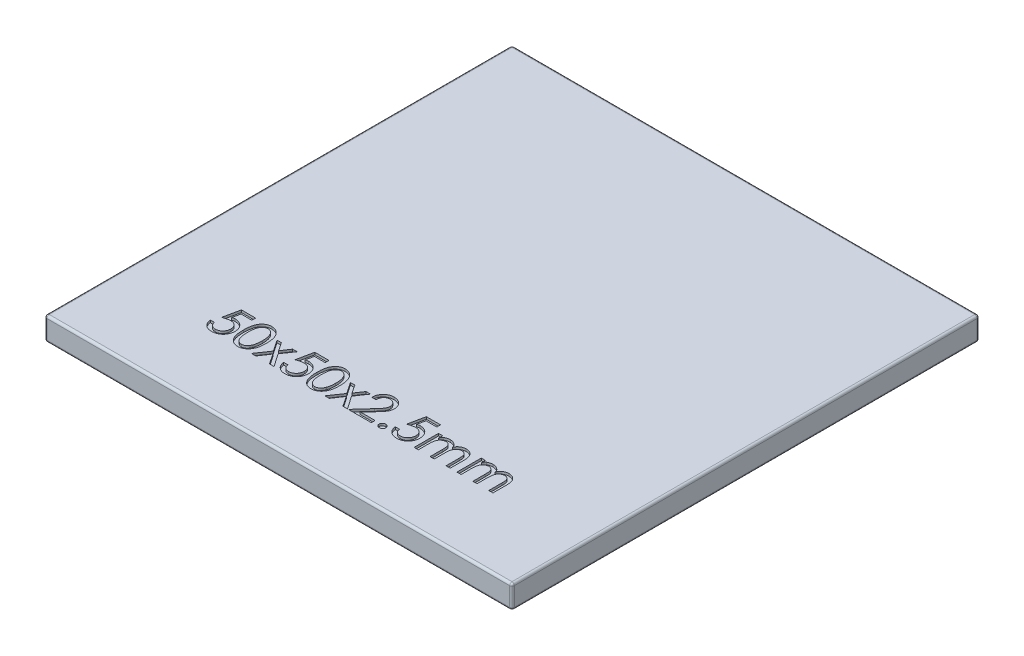
from build123d import *

# Parameters (mm, degrees)
ESQUISSE1_W             = 50
ESQUISSE1_H             = 50
BOSS_EXTRU_1_DEPTH      = 2.5
ENL_V_MAT_EXTRU_1_DEPTH = 0.25
CONG_1_R                = 0.25


with BuildPart() as part:
    # Esquisse1 → Boss.-Extru.1 (new body)
    with BuildSketch(Plane(origin=(0, 0, 0), x_dir=(1, 0, 0), z_dir=(0, 1, 0))):
        Rectangle(ESQUISSE1_W, ESQUISSE1_H)
    extrude(amount=BOSS_EXTRU_1_DEPTH)

    # Esquisse2 → Enlèv. mat.-Extru.1 (cut)
    # profile 1 of 11: a face of its own
    with BuildSketch(Plane(origin=(0, 2.5, 0), x_dir=(1, 0, 0), z_dir=(0, 1, 0))):
        with BuildLine():
            Line((-13.38499469, -14.045596726), (-13.38499469, -14.44944288))
            Line((-13.38499469, -14.44944288), (-14.534834434, -14.44944288))
            Line((-14.534834434, -14.44944288), (-14.722735075, -15.278869963))
            add(Edge.make_bspline(
                [(-14.722735075, -15.278869963), (-14.70081411, -15.26830555), (-14.655700591, -15.246563904), (-14.58027764, -15.227620307), (-14.498389797, -15.214291611), (-14.44118187, -15.212957207), (-14.411436998, -15.212263393)],
                knots=[0, 0, 0, 0, 0.906577793, 1.865744317, 2.890308309, 4, 4, 4, 4], degree=3))
            add(Edge.make_bspline(
                [(-14.411436998, -15.212263393), (-14.369309188, -15.213034712), (-14.286598278, -15.21454907), (-14.166053753, -15.231471453), (-14.051186261, -15.256823449), (-13.942940752, -15.294643919), (-13.840081092, -15.34120271), (-13.743723196, -15.399464273), (-13.653967144, -15.4684403), (-13.570932987, -15.54695631), (-13.495254616, -15.63247908), (-13.430257165, -15.72483536), (-13.373915452, -15.821327111), (-13.329256004, -15.923621805), (-13.293970415, -16.030661311), (-13.268876192, -16.142892995), (-13.252923094, -16.259980582), (-13.251234975, -16.339848851), (-13.250379306, -16.380332303)],
                knots=[0, 0, 0, 0, 1.094894284, 2.149641875, 3.159658044, 4.149576056, 5.125966368, 6.091225838, 7.071072142, 8.064343292, 9.05924964, 10.03573454, 10.996966885, 11.96032995, 12.932910184, 13.923798045, 14.947619342, 16, 16, 16, 16], degree=3))
            add(Edge.make_bspline(
                [(-13.250379306, -16.380332303), (-13.251037294, -16.408621201), (-13.252338906, -16.464581392), (-13.259121471, -16.547790572), (-13.272068141, -16.629204886), (-13.28925789, -16.709453181), (-13.312944013, -16.787847502), (-13.339907654, -16.865430069), (-13.373034638, -16.940964068), (-13.41085442, -17.014418008), (-13.452815165, -17.085254326), (-13.499015891, -17.152613722), (-13.549562156, -17.215957663), (-13.604633315, -17.274755973), (-13.66272401, -17.33052089), (-13.725349584, -17.381796998), (-13.792332072, -17.428799668), (-13.862716029, -17.472042705), (-13.93646781, -17.511109504), (-14.014020861, -17.543456021), (-14.093449877, -17.572845763), (-14.176719309, -17.594851881), (-14.262259074, -17.61336915), (-14.351095732, -17.625657796), (-14.442606562, -17.63366971), (-14.504668659, -17.63477706), (-14.536236677, -17.635340316)],
                knots=[0, 0, 0, 0, 1.012275937, 2.002451767, 2.98397589, 3.959820946, 4.936095762, 5.911940818, 6.896771482, 7.884012822, 8.866284557, 9.840372785, 10.804070441, 11.762530572, 12.720625922, 13.68308951, 14.655094125, 15.646011038, 16.637104318, 17.63729087, 18.650257215, 19.66446511, 20.715636712, 21.77986274, 22.870722459, 24, 24, 24, 24], degree=3))
            add(Edge.make_bspline(
                [(-14.536236677, -17.635340316), (-14.571791564, -17.63448672), (-14.641934004, -17.632802754), (-14.744952563, -17.620858768), (-14.843781968, -17.600593357), (-14.938003432, -17.571583661), (-15.028317967, -17.535197438), (-15.113955587, -17.490185576), (-15.195249081, -17.436952052), (-15.272303132, -17.376511708), (-15.342579468, -17.307565381), (-15.407358765, -17.233342434), (-15.462551263, -17.151110174), (-15.511103926, -17.06313791), (-15.552821368, -16.968710128), (-15.586009704, -16.867647792), (-15.612547686, -16.760333629), (-15.623154631, -16.686140859), (-15.628584434, -16.648160829)],
                knots=[0, 0, 0, 0, 1.049569621, 2.070583864, 3.057046508, 4.023914414, 4.977170942, 5.927726879, 6.875021894, 7.842677272, 8.813672282, 9.777581439, 10.74592533, 11.731059957, 12.74126976, 13.788569057, 14.867946107, 16, 16, 16, 16], degree=3))
            Line((-15.628584434, -16.648160829), (-15.190383312, -16.648160829))
            add(Edge.make_bspline(
                [(-15.190383312, -16.648160829), (-15.182043373, -16.684840389), (-15.166387354, -16.753696521), (-15.132753701, -16.847517676), (-15.096705811, -16.927313335), (-15.052615991, -16.99257233), (-15.002012059, -17.046139898), (-14.9458453, -17.092638085), (-14.884139146, -17.134347997), (-14.816207016, -17.168970778), (-14.744632979, -17.19702081), (-14.670265135, -17.216597857), (-14.594605371, -17.228907794), (-14.543527292, -17.230632473), (-14.518007511, -17.231494162)],
                knots=[0, 0, 0, 0, 1.385459112, 2.600831482, 3.66841355, 4.605180919, 5.48910649, 6.376050311, 7.288896949, 8.229144678, 9.181161654, 10.117453426, 11.059436513, 12, 12, 12, 12], degree=3))
            add(Edge.make_bspline(
                [(-14.518007511, -17.231494162), (-14.490400879, -17.230567347), (-14.435896778, -17.228737526), (-14.355603414, -17.217783243), (-14.278813124, -17.197520747), (-14.204417201, -17.171256892), (-14.133715111, -17.135484428), (-14.064971414, -17.093715487), (-14.000692796, -17.042424399), (-13.939082758, -16.985394746), (-13.882654166, -16.922225413), (-13.833518856, -16.85397374), (-13.791604297, -16.782010245), (-13.758202005, -16.705856278), (-13.73109316, -16.626209646), (-13.712459645, -16.542526342), (-13.700834242, -16.454981175), (-13.699683868, -16.395327156), (-13.699097254, -16.364907623)],
                knots=[0, 0, 0, 0, 0.99750234, 1.969380735, 2.919490565, 3.862219911, 4.813679117, 5.776605688, 6.762898166, 7.778387729, 8.806918829, 9.816812977, 10.811632172, 11.809420289, 12.815921014, 13.846113939, 14.901663155, 16, 16, 16, 16], degree=3))
            add(Edge.make_bspline(
                [(-13.699097254, -16.364907623), (-13.699794754, -16.337766464), (-13.701164354, -16.28447255), (-13.711196941, -16.206581659), (-13.727110648, -16.132283375), (-13.750234626, -16.062276151), (-13.779959631, -15.996172616), (-13.816512186, -15.934395646), (-13.859780889, -15.87660122), (-13.908440857, -15.822602044), (-13.963525004, -15.774353425), (-14.022669183, -15.731171801), (-14.087669314, -15.696247614), (-14.156181226, -15.666361547), (-14.229789672, -15.644519691), (-14.307176059, -15.626920114), (-14.38975029, -15.618464469), (-14.446245914, -15.616908209), (-14.475239081, -15.616109546)],
                knots=[0, 0, 0, 0, 1.071512717, 2.104004018, 3.095982969, 4.067795438, 5.009520676, 5.952827242, 6.895998369, 7.856350385, 8.817411605, 9.782937659, 10.74115891, 11.725120868, 12.729302161, 13.768330494, 14.854722481, 16, 16, 16, 16], degree=3))
            add(Edge.make_bspline(
                [(-14.475239081, -15.616109546), (-14.500032221, -15.616704548), (-14.552082866, -15.617953693), (-14.633532868, -15.626985931), (-14.722166627, -15.641192376), (-14.817843986, -15.660840669), (-14.920656886, -15.686438419), (-15.030730262, -15.717456616), (-15.14818591, -15.753651181), (-15.228323175, -15.781334314), (-15.269610075, -15.795596726)],
                knots=[0, 0, 0, 0, 0.727614075, 1.527550888, 2.402655696, 3.361819828, 4.39328773, 5.511706796, 6.718025739, 8, 8, 8, 8], degree=3))
            Line((-15.269610075, -15.795596726), (-14.902222254, -14.045596726))
            Line((-14.902222254, -14.045596726), (-13.38499469, -14.045596726))
        make_face()
    # profile 2 of 11: a face of its own
    with BuildSketch(Plane(origin=(0, 2.5, 0), x_dir=(1, 0, 0), z_dir=(0, 1, 0))):
        with BuildLine():
            add(Edge.make_bspline(
                [(-12.936276741, -15.79699897), (-12.935942684, -15.741369755), (-12.935293931, -15.633335649), (-12.92830333, -15.476173695), (-12.916244027, -15.328653606), (-12.900754276, -15.190771005), (-12.879324617, -15.062431158), (-12.854804648, -14.943570644), (-12.824621316, -14.83417484), (-12.789366151, -14.73404854), (-12.749781691, -14.641413469), (-12.706258388, -14.555109283), (-12.659071898, -14.47404024), (-12.608540914, -14.398234575), (-12.552276483, -14.329381132), (-12.493581709, -14.265121878), (-12.430252742, -14.206711206), (-12.362869934, -14.154441544), (-12.293166044, -14.10718477), (-12.220316872, -14.067353612), (-12.146010365, -14.032656877), (-12.069298948, -14.00459023), (-11.990738814, -13.982787796), (-11.910048614, -13.967561942), (-11.827612039, -13.95707677), (-11.771746309, -13.956262422), (-11.743668568, -13.955853136)],
                knots=[0, 0, 0, 0, 1.622528522, 3.151013738, 4.587225782, 5.939257941, 7.196658267, 8.381214254, 9.47772444, 10.503964975, 11.475138444, 12.414102326, 13.321377868, 14.209997518, 15.068075989, 15.912287155, 16.746865696, 17.577313739, 18.397854368, 19.200328723, 19.996378645, 20.787862277, 21.580050128, 22.371504404, 23.181529048, 24, 24, 24, 24], degree=3))
            add(Edge.make_bspline(
                [(-11.743668568, -13.955853136), (-11.71303882, -13.956659739), (-11.652581137, -13.958251829), (-11.562859019, -13.966916081), (-11.476145074, -13.984420752), (-11.391249547, -14.006372291), (-11.309547532, -14.03638052), (-11.229420615, -14.070888608), (-11.153335057, -14.114596332), (-11.078695732, -14.162406644), (-11.008061803, -14.217541376), (-10.940503252, -14.277449123), (-10.878126402, -14.34417484), (-10.818657503, -14.415422513), (-10.765146968, -14.49398249), (-10.714206491, -14.57710394), (-10.66910195, -14.666856978), (-10.626307583, -14.761653877), (-10.58952328, -14.864015284), (-10.556229968, -14.973356642), (-10.52924938, -15.091040216), (-10.506868077, -15.216700271), (-10.489620106, -15.350548366), (-10.476882039, -15.49226656), (-10.470231542, -15.641987347), (-10.468973818, -15.744409153), (-10.468328024, -15.79699897)],
                knots=[0, 0, 0, 0, 0.875057392, 1.727207867, 2.570264412, 3.399251263, 4.229017074, 5.053828049, 5.887584622, 6.731829445, 7.583639997, 8.443960147, 9.308026848, 10.190032267, 11.091770676, 12.020167189, 12.972467704, 13.958579741, 14.989078804, 16.076606933, 17.221320015, 18.435081626, 19.720875061, 21.074561036, 22.497895074, 24, 24, 24, 24], degree=3))
            add(Edge.make_bspline(
                [(-10.468328024, -15.79699897), (-10.468980588, -15.84935427), (-10.470251345, -15.951307311), (-10.476806397, -16.10033928), (-10.489874618, -16.241286721), (-10.505965006, -16.374545235), (-10.528534357, -16.499710109), (-10.556015132, -16.616847466), (-10.586832599, -16.726573181), (-10.62450546, -16.827925601), (-10.666220235, -16.922610547), (-10.711477952, -17.011561039), (-10.76132207, -17.094952367), (-10.81651226, -17.171879745), (-10.874418673, -17.244763767), (-10.937556972, -17.311071309), (-11.004776485, -17.372066238), (-11.075914631, -17.42697176), (-11.150157163, -17.476485512), (-11.227969818, -17.518281102), (-11.307391119, -17.55537885), (-11.390194333, -17.583493459), (-11.474700956, -17.607486971), (-11.562333952, -17.6229855), (-11.652279833, -17.633246848), (-11.713023946, -17.634638331), (-11.743668568, -17.635340316)],
                knots=[0, 0, 0, 0, 1.496607488, 2.914388442, 4.262485651, 5.541812885, 6.749953981, 7.895567619, 8.980172623, 10.005210728, 10.983286874, 11.936336572, 12.856292636, 13.757107149, 14.640766483, 15.514956722, 16.370989637, 17.232841377, 18.081413197, 18.918442167, 19.755471137, 20.583656588, 21.41504191, 22.264086897, 23.124254193, 24, 24, 24, 24], degree=3))
            add(Edge.make_bspline(
                [(-11.743668568, -17.635340316), (-11.77197137, -17.634859396), (-11.828027088, -17.6339069), (-11.91080235, -17.624565153), (-11.991437333, -17.609061119), (-12.069695208, -17.587331554), (-12.146125829, -17.559743356), (-12.220397744, -17.52632411), (-12.292022783, -17.485857491), (-12.361684485, -17.440389839), (-12.428371122, -17.38867373), (-12.490485124, -17.330221582), (-12.549519915, -17.266430317), (-12.604305974, -17.196612028), (-12.656053997, -17.121217423), (-12.702704071, -17.039536186), (-12.746197076, -16.952440701), (-12.786520554, -16.859260121), (-12.822928853, -16.758375483), (-12.85196775, -16.647813066), (-12.879351148, -16.528779315), (-12.89944662, -16.400070044), (-12.91688204, -16.262656261), (-12.926997323, -16.115645932), (-12.935641612, -15.959526623), (-12.93606115, -15.852168125), (-12.936276741, -15.79699897)],
                knots=[0, 0, 0, 0, 0.82614074, 1.636230647, 2.42850654, 3.22151677, 4.005075515, 4.799112676, 5.596456327, 6.404618302, 7.226350817, 8.05679228, 8.892237205, 9.761873943, 10.645770802, 11.559890835, 12.505927976, 13.487073095, 14.523090282, 15.633895838, 16.822583925, 18.088023083, 19.435493537, 20.865857947, 22.389433785, 24, 24, 24, 24], degree=3))
        make_face()
        with BuildLine():
            add(Edge.make_bspline(
                [(-12.487558793, -15.795596726), (-12.487378562, -15.842577407), (-12.487029647, -15.933528492), (-12.481848825, -16.065138702), (-12.474472732, -16.187688362), (-12.463439285, -16.301144244), (-12.448726544, -16.405675052), (-12.431312556, -16.501136429), (-12.411457997, -16.587711263), (-12.387251954, -16.665541814), (-12.360449579, -16.736457581), (-12.330648788, -16.801744465), (-12.299705602, -16.862881553), (-12.264849047, -16.918657065), (-12.227935093, -16.969833212), (-12.188297181, -17.016215194), (-12.147350326, -17.058819685), (-12.088938871, -17.106127951), (-12.01409629, -17.155588694), (-11.921188131, -17.198478174), (-11.827579881, -17.226789464), (-11.764426016, -17.229935982), (-11.733151741, -17.231494162)],
                knots=[0, 0, 0, 0, 1.564601651, 3.028951736, 4.386019676, 5.653114642, 6.824348509, 7.900668805, 8.88431448, 9.780488761, 10.613163047, 11.407444027, 12.169849642, 12.89344098, 13.595615509, 14.26934431, 14.924332585, 15.560171042, 16.769153194, 17.901006317, 18.960562374, 20, 20, 20, 20], degree=3))
            add(Edge.make_bspline(
                [(-11.733151741, -17.231494162), (-11.697711693, -17.229639816), (-11.627052144, -17.225942663), (-11.522987625, -17.199022716), (-11.423206885, -17.153841378), (-11.344145184, -17.102796679), (-11.284410876, -17.053149477), (-11.241271879, -17.010884841), (-11.201510152, -16.963699291), (-11.163973784, -16.912311349), (-11.130033358, -16.855880379), (-11.097306976, -16.795687153), (-11.068812432, -16.730287542), (-11.052344099, -16.684714146), (-11.043949017, -16.661482143)],
                knots=[0, 0, 0, 0, 1.331887272, 2.655486065, 4.012646414, 5.436183829, 6.178803566, 6.930724497, 7.703763371, 8.496530827, 9.320959298, 10.178042319, 11.071218497, 12, 12, 12, 12], degree=3))
            add(Edge.make_bspline(
                [(-11.043949017, -16.661482143), (-11.03383488, -16.630958588), (-11.013216511, -16.568734207), (-10.987384529, -16.47185497), (-10.965998828, -16.370199532), (-10.947584548, -16.264309264), (-10.933602557, -16.153650695), (-10.923938064, -16.038330414), (-10.918394372, -15.918347711), (-10.917500435, -15.836968542), (-10.917045972, -15.795596726)],
                knots=[0, 0, 0, 0, 0.877617242, 1.789083553, 2.735016418, 3.71249782, 4.722174671, 5.778575778, 6.870664861, 8, 8, 8, 8], degree=3))
            add(Edge.make_bspline(
                [(-10.917045972, -15.795596726), (-10.917154744, -15.754220673), (-10.917366869, -15.673530444), (-10.92367142, -15.555500379), (-10.931296103, -15.443151509), (-10.944450093, -15.336852794), (-10.959171469, -15.23607375), (-10.979364027, -15.141526883), (-11.001021705, -15.052268328), (-11.028078452, -14.96940051), (-11.057659548, -14.892087545), (-11.088859108, -14.820072086), (-11.122593569, -14.753296511), (-11.159760972, -14.69259868), (-11.198989673, -14.636977341), (-11.240426031, -14.586767004), (-11.284687481, -14.54225029), (-11.346566494, -14.492056745), (-11.426336309, -14.439816152), (-11.5260818, -14.392932972), (-11.629079004, -14.365293927), (-11.698641899, -14.361554435), (-11.733151741, -14.35969929)],
                knots=[0, 0, 0, 0, 1.353201578, 2.638969622, 3.865559904, 5.035676431, 6.141732754, 7.195734042, 8.19695873, 9.144657206, 10.044788335, 10.904062871, 11.710933862, 12.489720227, 13.229995877, 13.935715626, 14.616825307, 15.279494989, 16.538995736, 17.725922936, 18.871840505, 20, 20, 20, 20], degree=3))
            add(Edge.make_bspline(
                [(-11.733151741, -14.35969929), (-11.764416997, -14.361287915), (-11.827778026, -14.364507364), (-11.92152834, -14.392425459), (-12.01410204, -14.435655009), (-12.0884431, -14.485149987), (-12.146371487, -14.532408082), (-12.187877358, -14.574043537), (-12.226223564, -14.620687605), (-12.263228981, -14.671451818), (-12.297019043, -14.727594184), (-12.329838136, -14.788090553), (-12.358754044, -14.853940435), (-12.38594778, -14.924910531), (-12.409898865, -15.002883326), (-12.430611561, -15.089326027), (-12.449120859, -15.184681856), (-12.462460449, -15.289423621), (-12.473674162, -15.403051866), (-12.482066418, -15.525793592), (-12.486966475, -15.657668501), (-12.487357045, -15.74861725), (-12.487558793, -15.795596726)],
                knots=[0, 0, 0, 0, 1.039778295, 2.107176824, 3.232337611, 4.43520669, 5.071253539, 5.720927637, 6.389866065, 7.081397607, 7.811854436, 8.571243718, 9.372887587, 10.205834777, 11.102302774, 12.088086757, 13.166194718, 14.33675119, 15.604261439, 16.970055543, 18.43488556, 20, 20, 20, 20], degree=3))
        make_face(mode=Mode.SUBTRACT)
    # profile 3 of 11: a face of its own
    with BuildSketch(Plane(origin=(0, 2.5, 0), x_dir=(1, 0, 0), z_dir=(0, 1, 0))):
        Polygon((-10.199097254, -14.943032623), (-9.722334434, -14.943032623), (-9.126380908, -15.841870764), (-8.531128504, -14.943032623), (-8.0452511, -14.943032623), (-8.868368088, -16.149663232), (-7.910635716, -17.545596726), (-8.397214241, -17.545596726), (-9.12708203, -16.456754579), (-9.856248697, -17.545596726), (-10.333712639, -17.545596726), (-9.375279145, -16.150364354), align=None)
    # profile 4 of 11: a face of its own
    with BuildSketch(Plane(origin=(0, 2.5, 0), x_dir=(1, 0, 0), z_dir=(0, 1, 0))):
        with BuildLine():
            Line((-5.532430588, -14.045596726), (-5.532430588, -14.44944288))
            Line((-5.532430588, -14.44944288), (-6.682270331, -14.44944288))
            Line((-6.682270331, -14.44944288), (-6.870170972, -15.278869963))
            add(Edge.make_bspline(
                [(-6.870170972, -15.278869963), (-6.848250008, -15.26830555), (-6.803136489, -15.246563904), (-6.727713537, -15.227620307), (-6.645825694, -15.214291611), (-6.588617767, -15.212957207), (-6.558872895, -15.212263393)],
                knots=[0, 0, 0, 0, 0.906577793, 1.865744317, 2.890308309, 4, 4, 4, 4], degree=3))
            add(Edge.make_bspline(
                [(-6.558872895, -15.212263393), (-6.516745086, -15.213034712), (-6.434034175, -15.21454907), (-6.31348965, -15.231471453), (-6.198622159, -15.256823449), (-6.090376649, -15.294643919), (-5.987516989, -15.34120271), (-5.891159094, -15.399464273), (-5.801403042, -15.4684403), (-5.718368884, -15.54695631), (-5.642690514, -15.63247908), (-5.577693063, -15.72483536), (-5.521351349, -15.821327111), (-5.476691901, -15.923621805), (-5.441406313, -16.030661311), (-5.416312089, -16.142892995), (-5.400358991, -16.259980582), (-5.398670873, -16.339848851), (-5.397815203, -16.380332303)],
                knots=[0, 0, 0, 0, 1.094894284, 2.149641875, 3.159658044, 4.149576056, 5.125966368, 6.091225838, 7.071072142, 8.064343292, 9.05924964, 10.03573454, 10.996966885, 11.96032995, 12.932910184, 13.923798045, 14.947619342, 16, 16, 16, 16], degree=3))
            add(Edge.make_bspline(
                [(-5.397815203, -16.380332303), (-5.398473192, -16.408621201), (-5.399774804, -16.464581392), (-5.406557369, -16.547790572), (-5.419504038, -16.629204886), (-5.436693788, -16.709453181), (-5.460379911, -16.787847502), (-5.487343551, -16.865430069), (-5.520470535, -16.940964068), (-5.558290317, -17.014418008), (-5.600251062, -17.085254326), (-5.646451788, -17.152613722), (-5.696998053, -17.215957663), (-5.752069213, -17.274755973), (-5.810159908, -17.33052089), (-5.872785481, -17.381796998), (-5.939767969, -17.428799668), (-6.010151926, -17.472042705), (-6.083903707, -17.511109504), (-6.161456758, -17.543456021), (-6.240885774, -17.572845763), (-6.324155207, -17.594851881), (-6.409694971, -17.61336915), (-6.498531629, -17.625657796), (-6.590042459, -17.63366971), (-6.652104557, -17.63477706), (-6.683672575, -17.635340316)],
                knots=[0, 0, 0, 0, 1.012275937, 2.002451767, 2.98397589, 3.959820946, 4.936095762, 5.911940818, 6.896771482, 7.884012822, 8.866284557, 9.840372785, 10.804070441, 11.762530572, 12.720625922, 13.68308951, 14.655094125, 15.646011038, 16.637104318, 17.63729087, 18.650257215, 19.66446511, 20.715636712, 21.77986274, 22.870722459, 24, 24, 24, 24], degree=3))
            add(Edge.make_bspline(
                [(-6.683672575, -17.635340316), (-6.719227461, -17.63448672), (-6.789369902, -17.632802754), (-6.89238846, -17.620858768), (-6.991217865, -17.600593357), (-7.085439329, -17.571583661), (-7.175753864, -17.535197438), (-7.261391485, -17.490185576), (-7.342684978, -17.436952052), (-7.41973903, -17.376511708), (-7.490015366, -17.307565381), (-7.554794663, -17.233342434), (-7.609987161, -17.151110174), (-7.658539823, -17.06313791), (-7.700257265, -16.968710128), (-7.733445602, -16.867647792), (-7.759983583, -16.760333629), (-7.770590529, -16.686140859), (-7.776020331, -16.648160829)],
                knots=[0, 0, 0, 0, 1.049569621, 2.070583864, 3.057046508, 4.023914414, 4.977170942, 5.927726879, 6.875021894, 7.842677272, 8.813672282, 9.777581439, 10.74592533, 11.731059957, 12.74126976, 13.788569057, 14.867946107, 16, 16, 16, 16], degree=3))
            Line((-7.776020331, -16.648160829), (-7.337819209, -16.648160829))
            add(Edge.make_bspline(
                [(-7.337819209, -16.648160829), (-7.329479271, -16.684840389), (-7.313823251, -16.753696521), (-7.280189599, -16.847517676), (-7.244141708, -16.927313335), (-7.200051889, -16.99257233), (-7.149447956, -17.046139898), (-7.093281198, -17.092638085), (-7.031575044, -17.134347997), (-6.963642914, -17.168970778), (-6.892068876, -17.19702081), (-6.817701033, -17.216597857), (-6.742041269, -17.228907794), (-6.690963189, -17.230632473), (-6.665443408, -17.231494162)],
                knots=[0, 0, 0, 0, 1.385459112, 2.600831482, 3.66841355, 4.605180919, 5.48910649, 6.376050311, 7.288896949, 8.229144678, 9.181161654, 10.117453426, 11.059436513, 12, 12, 12, 12], degree=3))
            add(Edge.make_bspline(
                [(-6.665443408, -17.231494162), (-6.637836776, -17.230567347), (-6.583332675, -17.228737526), (-6.503039312, -17.217783243), (-6.426249022, -17.197520747), (-6.351853099, -17.171256892), (-6.281151009, -17.135484428), (-6.212407311, -17.093715487), (-6.148128693, -17.042424399), (-6.086518655, -16.985394746), (-6.030090063, -16.922225413), (-5.980954753, -16.85397374), (-5.939040194, -16.782010245), (-5.905637902, -16.705856278), (-5.878529058, -16.626209646), (-5.859895542, -16.542526342), (-5.848270139, -16.454981175), (-5.847119765, -16.395327156), (-5.846533152, -16.364907623)],
                knots=[0, 0, 0, 0, 0.99750234, 1.969380735, 2.919490565, 3.862219911, 4.813679117, 5.776605688, 6.762898166, 7.778387729, 8.806918829, 9.816812977, 10.811632172, 11.809420289, 12.815921014, 13.846113939, 14.901663155, 16, 16, 16, 16], degree=3))
            add(Edge.make_bspline(
                [(-5.846533152, -16.364907623), (-5.847230652, -16.337766464), (-5.848600251, -16.28447255), (-5.858632839, -16.206581659), (-5.874546545, -16.132283375), (-5.897670523, -16.062276151), (-5.927395529, -15.996172616), (-5.963948083, -15.934395646), (-6.007216787, -15.87660122), (-6.055876755, -15.822602044), (-6.110960901, -15.774353425), (-6.170105081, -15.731171801), (-6.235105212, -15.696247614), (-6.303617123, -15.666361547), (-6.37722557, -15.644519691), (-6.454611956, -15.626920114), (-6.537186187, -15.618464469), (-6.593681811, -15.616908209), (-6.622674979, -15.616109546)],
                knots=[0, 0, 0, 0, 1.071512717, 2.104004018, 3.095982969, 4.067795438, 5.009520676, 5.952827242, 6.895998369, 7.856350385, 8.817411605, 9.782937659, 10.74115891, 11.725120868, 12.729302161, 13.768330494, 14.854722481, 16, 16, 16, 16], degree=3))
            add(Edge.make_bspline(
                [(-6.622674979, -15.616109546), (-6.647468118, -15.616704548), (-6.699518763, -15.617953693), (-6.780968766, -15.626985931), (-6.869602524, -15.641192376), (-6.965279883, -15.660840669), (-7.068092783, -15.686438419), (-7.178166159, -15.717456616), (-7.295621807, -15.753651181), (-7.375759073, -15.781334314), (-7.417045972, -15.795596726)],
                knots=[0, 0, 0, 0, 0.727614075, 1.527550888, 2.402655696, 3.361819828, 4.39328773, 5.511706796, 6.718025739, 8, 8, 8, 8], degree=3))
            Line((-7.417045972, -15.795596726), (-7.049658152, -14.045596726))
            Line((-7.049658152, -14.045596726), (-5.532430588, -14.045596726))
        make_face()
    # profile 5 of 11: a face of its own
    with BuildSketch(Plane(origin=(0, 2.5, 0), x_dir=(1, 0, 0), z_dir=(0, 1, 0))):
        with BuildLine():
            add(Edge.make_bspline(
                [(-5.083712639, -15.79699897), (-5.083378581, -15.741369755), (-5.082729828, -15.633335649), (-5.075739228, -15.476173695), (-5.063679925, -15.328653606), (-5.048190174, -15.190771005), (-5.026760514, -15.062431158), (-5.002240545, -14.943570644), (-4.972057214, -14.83417484), (-4.936802049, -14.73404854), (-4.897217588, -14.641413469), (-4.853694286, -14.555109283), (-4.806507796, -14.47404024), (-4.755976812, -14.398234575), (-4.69971238, -14.329381132), (-4.641017607, -14.265121878), (-4.577688639, -14.206711206), (-4.510305832, -14.154441544), (-4.440601941, -14.10718477), (-4.367752769, -14.067353612), (-4.293446262, -14.032656877), (-4.216734845, -14.00459023), (-4.138174711, -13.982787796), (-4.057484511, -13.967561942), (-3.975047936, -13.95707677), (-3.919182206, -13.956262422), (-3.891104466, -13.955853136)],
                knots=[0, 0, 0, 0, 1.622528522, 3.151013738, 4.587225782, 5.939257941, 7.196658267, 8.381214254, 9.47772444, 10.503964975, 11.475138444, 12.414102326, 13.321377868, 14.209997518, 15.068075989, 15.912287155, 16.746865696, 17.577313739, 18.397854368, 19.200328723, 19.996378645, 20.787862277, 21.580050128, 22.371504404, 23.181529048, 24, 24, 24, 24], degree=3))
            add(Edge.make_bspline(
                [(-3.891104466, -13.955853136), (-3.860474717, -13.956659739), (-3.800017034, -13.958251829), (-3.710294916, -13.966916081), (-3.623580972, -13.984420752), (-3.538685444, -14.006372291), (-3.45698343, -14.03638052), (-3.376856513, -14.070888608), (-3.300770954, -14.114596332), (-3.226131629, -14.162406644), (-3.1554977, -14.217541376), (-3.08793915, -14.277449123), (-3.0255623, -14.34417484), (-2.966093401, -14.415422513), (-2.912582865, -14.49398249), (-2.861642388, -14.57710394), (-2.816537848, -14.666856978), (-2.773743481, -14.761653877), (-2.736959178, -14.864015284), (-2.703665865, -14.973356642), (-2.676685278, -15.091040216), (-2.654303974, -15.216700271), (-2.637056004, -15.350548366), (-2.624317936, -15.49226656), (-2.617667439, -15.641987347), (-2.616409716, -15.744409153), (-2.615763921, -15.79699897)],
                knots=[0, 0, 0, 0, 0.875057392, 1.727207867, 2.570264412, 3.399251263, 4.229017074, 5.053828049, 5.887584622, 6.731829445, 7.583639997, 8.443960147, 9.308026848, 10.190032267, 11.091770676, 12.020167189, 12.972467704, 13.958579741, 14.989078804, 16.076606933, 17.221320015, 18.435081626, 19.720875061, 21.074561036, 22.497895074, 24, 24, 24, 24], degree=3))
            add(Edge.make_bspline(
                [(-2.615763921, -15.79699897), (-2.616416485, -15.84935427), (-2.617687242, -15.951307311), (-2.624242294, -16.10033928), (-2.637310515, -16.241286721), (-2.653400903, -16.374545235), (-2.675970255, -16.499710109), (-2.70345103, -16.616847466), (-2.734268496, -16.726573181), (-2.771941357, -16.827925601), (-2.813656132, -16.922610547), (-2.858913849, -17.011561039), (-2.908757967, -17.094952367), (-2.963948157, -17.171879745), (-3.02185457, -17.244763767), (-3.08499287, -17.311071309), (-3.152212383, -17.372066238), (-3.223350529, -17.42697176), (-3.29759306, -17.476485512), (-3.375405715, -17.518281102), (-3.454827016, -17.55537885), (-3.53763023, -17.583493459), (-3.622136853, -17.607486971), (-3.70976985, -17.6229855), (-3.79971573, -17.633246848), (-3.860459843, -17.634638331), (-3.891104466, -17.635340316)],
                knots=[0, 0, 0, 0, 1.496607488, 2.914388442, 4.262485651, 5.541812885, 6.749953981, 7.895567619, 8.980172623, 10.005210728, 10.983286874, 11.936336572, 12.856292636, 13.757107149, 14.640766483, 15.514956722, 16.370989637, 17.232841377, 18.081413197, 18.918442167, 19.755471137, 20.583656588, 21.41504191, 22.264086897, 23.124254193, 24, 24, 24, 24], degree=3))
            add(Edge.make_bspline(
                [(-3.891104466, -17.635340316), (-3.919407268, -17.634859396), (-3.975462985, -17.6339069), (-4.058238247, -17.624565153), (-4.13887323, -17.609061119), (-4.217131106, -17.587331554), (-4.293561726, -17.559743356), (-4.367833641, -17.52632411), (-4.439458681, -17.485857491), (-4.509120382, -17.440389839), (-4.57580702, -17.38867373), (-4.637921022, -17.330221582), (-4.696955812, -17.266430317), (-4.751741871, -17.196612028), (-4.803489895, -17.121217423), (-4.850139968, -17.039536186), (-4.893632974, -16.952440701), (-4.933956451, -16.859260121), (-4.97036475, -16.758375483), (-4.999403648, -16.647813066), (-5.026787046, -16.528779315), (-5.046882518, -16.400070044), (-5.064317937, -16.262656261), (-5.074433221, -16.115645932), (-5.083077509, -15.959526623), (-5.083497047, -15.852168125), (-5.083712639, -15.79699897)],
                knots=[0, 0, 0, 0, 0.82614074, 1.636230647, 2.42850654, 3.22151677, 4.005075515, 4.799112676, 5.596456327, 6.404618302, 7.226350817, 8.05679228, 8.892237205, 9.761873943, 10.645770802, 11.559890835, 12.505927976, 13.487073095, 14.523090282, 15.633895838, 16.822583925, 18.088023083, 19.435493537, 20.865857947, 22.389433785, 24, 24, 24, 24], degree=3))
        make_face()
        with BuildLine():
            add(Edge.make_bspline(
                [(-4.63499469, -15.795596726), (-4.634814459, -15.842577407), (-4.634465545, -15.933528492), (-4.629284722, -16.065138702), (-4.621908629, -16.187688362), (-4.610875183, -16.301144244), (-4.596162441, -16.405675052), (-4.578748454, -16.501136429), (-4.558893894, -16.587711263), (-4.534687851, -16.665541814), (-4.507885477, -16.736457581), (-4.478084686, -16.801744465), (-4.447141499, -16.862881553), (-4.412284944, -16.918657065), (-4.37537099, -16.969833212), (-4.335733079, -17.016215194), (-4.294786224, -17.058819685), (-4.236374769, -17.106127951), (-4.161532188, -17.155588694), (-4.068624029, -17.198478174), (-3.975015778, -17.226789464), (-3.911861913, -17.229935982), (-3.880587639, -17.231494162)],
                knots=[0, 0, 0, 0, 1.564601651, 3.028951736, 4.386019676, 5.653114642, 6.824348509, 7.900668805, 8.88431448, 9.780488761, 10.613163047, 11.407444027, 12.169849642, 12.89344098, 13.595615509, 14.26934431, 14.924332585, 15.560171042, 16.769153194, 17.901006317, 18.960562374, 20, 20, 20, 20], degree=3))
            add(Edge.make_bspline(
                [(-3.880587639, -17.231494162), (-3.845147591, -17.229639816), (-3.774488041, -17.225942663), (-3.670423522, -17.199022716), (-3.570642782, -17.153841378), (-3.491581081, -17.102796679), (-3.431846774, -17.053149477), (-3.388707776, -17.010884841), (-3.348946049, -16.963699291), (-3.311409681, -16.912311349), (-3.277469255, -16.855880379), (-3.244742874, -16.795687153), (-3.21624833, -16.730287542), (-3.199779996, -16.684714146), (-3.191384915, -16.661482143)],
                knots=[0, 0, 0, 0, 1.331887272, 2.655486065, 4.012646414, 5.436183829, 6.178803566, 6.930724497, 7.703763371, 8.496530827, 9.320959298, 10.178042319, 11.071218497, 12, 12, 12, 12], degree=3))
            add(Edge.make_bspline(
                [(-3.191384915, -16.661482143), (-3.181270778, -16.630958588), (-3.160652409, -16.568734207), (-3.134820427, -16.47185497), (-3.113434726, -16.370199532), (-3.095020445, -16.264309264), (-3.081038455, -16.153650695), (-3.071373962, -16.038330414), (-3.06583027, -15.918347711), (-3.064936332, -15.836968542), (-3.06448187, -15.795596726)],
                knots=[0, 0, 0, 0, 0.877617242, 1.789083553, 2.735016418, 3.71249782, 4.722174671, 5.778575778, 6.870664861, 8, 8, 8, 8], degree=3))
            add(Edge.make_bspline(
                [(-3.06448187, -15.795596726), (-3.064590642, -15.754220673), (-3.064802766, -15.673530444), (-3.071107317, -15.555500379), (-3.078732, -15.443151509), (-3.09188599, -15.336852794), (-3.106607367, -15.23607375), (-3.126799925, -15.141526883), (-3.148457602, -15.052268328), (-3.175514349, -14.96940051), (-3.205095445, -14.892087545), (-3.236295005, -14.820072086), (-3.270029467, -14.753296511), (-3.307196869, -14.69259868), (-3.34642557, -14.636977341), (-3.387861929, -14.586767004), (-3.432123379, -14.54225029), (-3.494002392, -14.492056745), (-3.573772206, -14.439816152), (-3.673517697, -14.392932972), (-3.776514901, -14.365293927), (-3.846077797, -14.361554435), (-3.880587639, -14.35969929)],
                knots=[0, 0, 0, 0, 1.353201578, 2.638969622, 3.865559904, 5.035676431, 6.141732754, 7.195734042, 8.19695873, 9.144657206, 10.044788335, 10.904062871, 11.710933862, 12.489720227, 13.229995877, 13.935715626, 14.616825307, 15.279494989, 16.538995736, 17.725922936, 18.871840505, 20, 20, 20, 20], degree=3))
            add(Edge.make_bspline(
                [(-3.880587639, -14.35969929), (-3.911852895, -14.361287915), (-3.975213924, -14.364507364), (-4.068964237, -14.392425459), (-4.161537937, -14.435655009), (-4.235878997, -14.485149987), (-4.293807384, -14.532408082), (-4.335313255, -14.574043537), (-4.373659461, -14.620687605), (-4.410664879, -14.671451818), (-4.444454941, -14.727594184), (-4.477274034, -14.788090553), (-4.506189941, -14.853940435), (-4.533383677, -14.924910531), (-4.557334763, -15.002883326), (-4.578047459, -15.089326027), (-4.596556757, -15.184681856), (-4.609896346, -15.289423621), (-4.621110059, -15.403051866), (-4.629502316, -15.525793592), (-4.634402372, -15.657668501), (-4.634792942, -15.74861725), (-4.63499469, -15.795596726)],
                knots=[0, 0, 0, 0, 1.039778295, 2.107176824, 3.232337611, 4.43520669, 5.071253539, 5.720927637, 6.389866065, 7.081397607, 7.811854436, 8.571243718, 9.372887587, 10.205834777, 11.102302774, 12.088086757, 13.166194718, 14.33675119, 15.604261439, 16.970055543, 18.43488556, 20, 20, 20, 20], degree=3))
        make_face(mode=Mode.SUBTRACT)
    # profile 6 of 11: a face of its own
    with BuildSketch(Plane(origin=(0, 2.5, 0), x_dir=(1, 0, 0), z_dir=(0, 1, 0))):
        Polygon((-2.346533152, -14.943032623), (-1.869770331, -14.943032623), (-1.273816806, -15.841870764), (-0.678564402, -14.943032623), (-0.192686998, -14.943032623), (-1.015803985, -16.149663232), (-0.058071613, -17.545596726), (-0.544650139, -17.545596726), (-1.274517927, -16.456754579), (-2.003684594, -17.545596726), (-2.481148536, -17.545596726), (-1.522715043, -16.150364354), align=None)
    # profile 7 of 11: a face of its own
    with BuildSketch(Plane(origin=(0, 2.5, 0), x_dir=(1, 0, 0), z_dir=(0, 1, 0))):
        with BuildLine():
            Line((0.610097457, -15.167391598), (0.166287361, -15.167391598))
            add(Edge.make_bspline(
                [(0.166287361, -15.167391598), (0.168372071, -15.122231534), (0.172449477, -15.033904645), (0.190555261, -14.9052025), (0.219885343, -14.783932249), (0.256906097, -14.669065843), (0.306290751, -14.562039175), (0.363270764, -14.460986494), (0.432058731, -14.368025667), (0.509792892, -14.283009637), (0.594176069, -14.205769265), (0.684888379, -14.139166359), (0.780396505, -14.082410849), (0.880719229, -14.036097977), (0.98605302, -14.000238805), (1.096097639, -13.974144984), (1.211204139, -13.95845017), (1.289669324, -13.956726816), (1.329448419, -13.955853136)],
                knots=[0, 0, 0, 0, 1.154964179, 2.258951466, 3.315045469, 4.34063582, 5.337653555, 6.322213479, 7.300594401, 8.285733883, 9.262436119, 10.219305053, 11.156568068, 12.097250375, 13.037875795, 13.995471444, 14.983774372, 16, 16, 16, 16], degree=3))
            add(Edge.make_bspline(
                [(1.329448419, -13.955853136), (1.371097217, -13.95670509), (1.452823675, -13.95837686), (1.571837083, -13.974108413), (1.68447238, -13.999475532), (1.790762544, -14.034117897), (1.890513924, -14.080374476), (1.983923223, -14.136154809), (2.070092544, -14.203200755), (2.1496473, -14.278220983), (2.219914721, -14.360743851), (2.283380634, -14.445587162), (2.335841355, -14.534471635), (2.379790216, -14.62577422), (2.413609557, -14.720244275), (2.43749267, -14.817497348), (2.451808607, -14.917599524), (2.45376258, -14.985287572), (2.4547489, -15.019454899)],
                knots=[0, 0, 0, 0, 1.156722346, 2.269809107, 3.328396062, 4.361258308, 5.3694338, 6.377253737, 7.377324894, 8.397019439, 9.4098266, 10.385180797, 11.337325354, 12.27255833, 13.196816462, 14.119704983, 15.050871513, 16, 16, 16, 16], degree=3))
            add(Edge.make_bspline(
                [(2.4547489, -15.019454899), (2.452954096, -15.067249382), (2.449389078, -15.162183603), (2.421937329, -15.302633335), (2.375787724, -15.438559348), (2.322480514, -15.549238772), (2.268566703, -15.638702529), (2.219090367, -15.712546825), (2.160968474, -15.792394925), (2.092954569, -15.877712322), (2.017753161, -15.970451108), (1.932376957, -16.068218913), (1.839468477, -16.172995113), (1.773207595, -16.243546561), (1.738903547, -16.280071886)],
                knots=[0, 0, 0, 0, 1.155755081, 2.295677249, 3.447123235, 4.6205014, 5.259503175, 5.973005395, 6.77029923, 7.648035671, 8.612336498, 9.658570495, 10.787814065, 12, 12, 12, 12], degree=3))
            Line((1.738903547, -16.280071886), (0.877925983, -17.141750572))
            Line((0.877925983, -17.141750572), (2.499620694, -17.141750572))
            Line((2.499620694, -17.141750572), (2.499620694, -17.545596726))
            Line((2.499620694, -17.545596726), (0.031671976, -17.545596726))
            Line((0.031671976, -17.545596726), (1.370814605, -16.066930861))
            add(Edge.make_bspline(
                [(1.370814605, -16.066930861), (1.402711207, -16.032913492), (1.46392137, -15.967633539), (1.550188428, -15.87207417), (1.628020627, -15.783731025), (1.697832921, -15.702667878), (1.75779721, -15.627795155), (1.809526653, -15.560214364), (1.852435662, -15.499606375), (1.896996873, -15.428265726), (1.941152463, -15.342747689), (1.978714824, -15.238427691), (2.00125408, -15.131894344), (2.004437882, -15.060224155), (2.006030951, -15.024362752)],
                knots=[0, 0, 0, 0, 1.341560447, 2.574479018, 3.703506985, 4.728875774, 5.651874962, 6.462761537, 7.177175968, 7.787249671, 8.88179658, 9.938774664, 10.968630673, 12, 12, 12, 12], degree=3))
            add(Edge.make_bspline(
                [(2.006030951, -15.024362752), (2.005638352, -15.002115695), (2.004861515, -14.958095386), (1.994270621, -14.893632924), (1.979351446, -14.831107922), (1.956276699, -14.771525595), (1.928475875, -14.713713725), (1.893701991, -14.658419656), (1.851944739, -14.606156301), (1.805493726, -14.555747768), (1.754117684, -14.510234571), (1.699852307, -14.469415891), (1.64203026, -14.436265813), (1.582232486, -14.407275489), (1.518600134, -14.386723246), (1.452697365, -14.371421044), (1.38400671, -14.360820901), (1.337201601, -14.3600782), (1.313322617, -14.35969929)],
                knots=[0, 0, 0, 0, 0.999432927, 1.977580462, 2.931018689, 3.885672852, 4.844657058, 5.812871023, 6.815890212, 7.849665183, 8.891901864, 9.898878619, 10.897592748, 11.885014695, 12.882178885, 13.896915602, 14.927050508, 16, 16, 16, 16], degree=3))
            add(Edge.make_bspline(
                [(1.313322617, -14.35969929), (1.290620988, -14.360164905), (1.245960923, -14.361080891), (1.180187923, -14.370531751), (1.117053987, -14.385919609), (1.056346135, -14.407263971), (0.997624672, -14.433596736), (0.942325435, -14.467710781), (0.889544576, -14.507395927), (0.838584319, -14.55193653), (0.792204608, -14.604191524), (0.750721401, -14.663541678), (0.714090092, -14.730051659), (0.682779322, -14.803605117), (0.656830556, -14.88439502), (0.63601455, -14.972323131), (0.619921764, -15.067427716), (0.613432807, -15.133453887), (0.610097457, -15.167391598)],
                knots=[0, 0, 0, 0, 0.911540883, 1.79324023, 2.663162255, 3.518366492, 4.375475705, 5.243419306, 6.122264358, 7.02676621, 7.957780629, 8.921596253, 9.930241338, 11.002848587, 12.128200329, 13.335197372, 14.630280975, 16, 16, 16, 16], degree=3))
        make_face()
    # profile 8 of 11: a face of its own
    with BuildSketch(Plane(origin=(0, 2.5, 0), x_dir=(1, 0, 0), z_dir=(0, 1, 0))):
        with BuildLine():
            add(Edge.make_bspline(
                [(3.374620694, -16.917391598), (3.401863534, -16.918434747), (3.454324925, -16.920443534), (3.528817681, -16.940611946), (3.595159297, -16.974113279), (3.650761087, -17.020662126), (3.697382232, -17.073165631), (3.730486079, -17.130786632), (3.752902003, -17.191086172), (3.754985675, -17.232936032), (3.756030951, -17.253930059)],
                knots=[0, 0, 0, 0, 1.15701891, 2.228065191, 3.255424824, 4.294461548, 5.295444851, 6.226722199, 7.110433302, 8, 8, 8, 8], degree=3))
            add(Edge.make_bspline(
                [(3.756030951, -17.253930059), (3.754891511, -17.274661371), (3.75261154, -17.316143854), (3.731421328, -17.376542005), (3.697804764, -17.434032365), (3.651714227, -17.487131489), (3.596023613, -17.533907403), (3.529014003, -17.566328086), (3.454683195, -17.587617397), (3.401887634, -17.589497512), (3.374620694, -17.590468521)],
                knots=[0, 0, 0, 0, 0.879435236, 1.759712977, 2.690738283, 3.698978083, 4.737733602, 5.760330622, 6.843294226, 8, 8, 8, 8], degree=3))
            add(Edge.make_bspline(
                [(3.374620694, -17.590468521), (3.352064207, -17.589246444), (3.307817023, -17.586849196), (3.24407616, -17.568152107), (3.186248062, -17.536282241), (3.134728144, -17.493838305), (3.092025864, -17.44219233), (3.060735534, -17.38409534), (3.041575888, -17.320548063), (3.039265854, -17.276499686), (3.038082233, -17.253930059)],
                knots=[0, 0, 0, 0, 1.022542034, 2.005835645, 2.98339371, 4.000421564, 5.017449418, 6.004339308, 6.977457966, 8, 8, 8, 8], degree=3))
            add(Edge.make_bspline(
                [(3.038082233, -17.253930059), (3.039282021, -17.231134957), (3.041623753, -17.186643743), (3.060433565, -17.122712541), (3.092051424, -17.064908017), (3.134971369, -17.014020507), (3.186327376, -16.971309657), (3.244463447, -16.940051515), (3.308000576, -16.920883511), (3.352050351, -16.918574629), (3.374620694, -16.917391598)],
                knots=[0, 0, 0, 0, 1.03279153, 2.015790415, 2.993055472, 4.001620375, 5.018343391, 6.004937476, 6.977764458, 8, 8, 8, 8], degree=3))
        make_face()
    # profile 9 of 11: a face of its own
    with BuildSketch(Plane(origin=(0, 2.5, 0), x_dir=(1, 0, 0), z_dir=(0, 1, 0))):
        with BuildLine():
            Line((6.403466848, -14.045596726), (6.403466848, -14.44944288))
            Line((6.403466848, -14.44944288), (5.253627105, -14.44944288))
            Line((5.253627105, -14.44944288), (5.065726464, -15.278869963))
            add(Edge.make_bspline(
                [(5.065726464, -15.278869963), (5.087647428, -15.26830555), (5.132760947, -15.246563904), (5.208183898, -15.227620307), (5.290071742, -15.214291611), (5.347279669, -15.212957207), (5.377024541, -15.212263393)],
                knots=[0, 0, 0, 0, 0.906577793, 1.865744317, 2.890308309, 4, 4, 4, 4], degree=3))
            add(Edge.make_bspline(
                [(5.377024541, -15.212263393), (5.41915235, -15.213034712), (5.501863261, -15.21454907), (5.622407785, -15.231471453), (5.737275277, -15.256823449), (5.845520787, -15.294643919), (5.948380446, -15.34120271), (6.044738342, -15.399464273), (6.134494394, -15.4684403), (6.217528552, -15.54695631), (6.293206922, -15.63247908), (6.358204373, -15.72483536), (6.414546087, -15.821327111), (6.459205534, -15.923621805), (6.494491123, -16.030661311), (6.519585347, -16.142892995), (6.535538445, -16.259980582), (6.537226563, -16.339848851), (6.538082233, -16.380332303)],
                knots=[0, 0, 0, 0, 1.094894284, 2.149641875, 3.159658044, 4.149576056, 5.125966368, 6.091225838, 7.071072142, 8.064343292, 9.05924964, 10.03573454, 10.996966885, 11.96032995, 12.932910184, 13.923798045, 14.947619342, 16, 16, 16, 16], degree=3))
            add(Edge.make_bspline(
                [(6.538082233, -16.380332303), (6.537424244, -16.408621201), (6.536122632, -16.464581392), (6.529340067, -16.547790572), (6.516393398, -16.629204886), (6.499203648, -16.709453181), (6.475517525, -16.787847502), (6.448553885, -16.865430069), (6.415426901, -16.940964068), (6.377607119, -17.014418008), (6.335646373, -17.085254326), (6.289445648, -17.152613722), (6.238899383, -17.215957663), (6.183828223, -17.274755973), (6.125737528, -17.33052089), (6.063111954, -17.381796998), (5.996129467, -17.428799668), (5.925745509, -17.472042705), (5.851993729, -17.511109504), (5.774440678, -17.543456021), (5.695011662, -17.572845763), (5.611742229, -17.594851881), (5.526202465, -17.61336915), (5.437365807, -17.625657796), (5.345854977, -17.63366971), (5.283792879, -17.63477706), (5.252224861, -17.635340316)],
                knots=[0, 0, 0, 0, 1.012275937, 2.002451767, 2.98397589, 3.959820946, 4.936095762, 5.911940818, 6.896771482, 7.884012822, 8.866284557, 9.840372785, 10.804070441, 11.762530572, 12.720625922, 13.68308951, 14.655094125, 15.646011038, 16.637104318, 17.63729087, 18.650257215, 19.66446511, 20.715636712, 21.77986274, 22.870722459, 24, 24, 24, 24], degree=3))
            add(Edge.make_bspline(
                [(5.252224861, -17.635340316), (5.216669975, -17.63448672), (5.146527534, -17.632802754), (5.043508976, -17.620858768), (4.944679571, -17.600593357), (4.850458107, -17.571583661), (4.760143571, -17.535197438), (4.674505951, -17.490185576), (4.593212458, -17.436952052), (4.516158406, -17.376511708), (4.44588207, -17.307565381), (4.381102773, -17.233342434), (4.325910275, -17.151110174), (4.277357613, -17.06313791), (4.235640171, -16.968710128), (4.202451834, -16.867647792), (4.175913853, -16.760333629), (4.165306907, -16.686140859), (4.159877105, -16.648160829)],
                knots=[0, 0, 0, 0, 1.049569621, 2.070583864, 3.057046508, 4.023914414, 4.977170942, 5.927726879, 6.875021894, 7.842677272, 8.813672282, 9.777581439, 10.74592533, 11.731059957, 12.74126976, 13.788569057, 14.867946107, 16, 16, 16, 16], degree=3))
            Line((4.159877105, -16.648160829), (4.598078226, -16.648160829))
            add(Edge.make_bspline(
                [(4.598078226, -16.648160829), (4.606418165, -16.684840389), (4.622074185, -16.753696521), (4.655707837, -16.847517676), (4.691755728, -16.927313335), (4.735845547, -16.99257233), (4.78644948, -17.046139898), (4.842616238, -17.092638085), (4.904322392, -17.134347997), (4.972254522, -17.168970778), (5.043828559, -17.19702081), (5.118196403, -17.216597857), (5.193856167, -17.228907794), (5.244934247, -17.230632473), (5.270454028, -17.231494162)],
                knots=[0, 0, 0, 0, 1.385459112, 2.600831482, 3.66841355, 4.605180919, 5.48910649, 6.376050311, 7.288896949, 8.229144678, 9.181161654, 10.117453426, 11.059436513, 12, 12, 12, 12], degree=3))
            add(Edge.make_bspline(
                [(5.270454028, -17.231494162), (5.298060659, -17.230567347), (5.352564761, -17.228737526), (5.432858124, -17.217783243), (5.509648414, -17.197520747), (5.584044337, -17.171256892), (5.654746427, -17.135484428), (5.723490125, -17.093715487), (5.787768743, -17.042424399), (5.849378781, -16.985394746), (5.905807373, -16.922225413), (5.954942683, -16.85397374), (5.996857242, -16.782010245), (6.030259534, -16.705856278), (6.057368378, -16.626209646), (6.076001894, -16.542526342), (6.087627297, -16.454981175), (6.088777671, -16.395327156), (6.089364284, -16.364907623)],
                knots=[0, 0, 0, 0, 0.99750234, 1.969380735, 2.919490565, 3.862219911, 4.813679117, 5.776605688, 6.762898166, 7.778387729, 8.806918829, 9.816812977, 10.811632172, 11.809420289, 12.815921014, 13.846113939, 14.901663155, 16, 16, 16, 16], degree=3))
            add(Edge.make_bspline(
                [(6.089364284, -16.364907623), (6.088666784, -16.337766464), (6.087297185, -16.28447255), (6.077264597, -16.206581659), (6.061350891, -16.132283375), (6.038226913, -16.062276151), (6.008501907, -15.996172616), (5.971949353, -15.934395646), (5.928680649, -15.87660122), (5.880020681, -15.822602044), (5.824936535, -15.774353425), (5.765792355, -15.731171801), (5.700792224, -15.696247614), (5.632280312, -15.666361547), (5.558671866, -15.644519691), (5.48128548, -15.626920114), (5.398711249, -15.618464469), (5.342215625, -15.616908209), (5.313222457, -15.616109546)],
                knots=[0, 0, 0, 0, 1.071512717, 2.104004018, 3.095982969, 4.067795438, 5.009520676, 5.952827242, 6.895998369, 7.856350385, 8.817411605, 9.782937659, 10.74115891, 11.725120868, 12.729302161, 13.768330494, 14.854722481, 16, 16, 16, 16], degree=3))
            add(Edge.make_bspline(
                [(5.313222457, -15.616109546), (5.288429318, -15.616704548), (5.236378673, -15.617953693), (5.15492867, -15.626985931), (5.066294912, -15.641192376), (4.970617553, -15.660840669), (4.867804653, -15.686438419), (4.757731277, -15.717456616), (4.640275628, -15.753651181), (4.560138363, -15.781334314), (4.518851464, -15.795596726)],
                knots=[0, 0, 0, 0, 0.727614075, 1.527550888, 2.402655696, 3.361819828, 4.39328773, 5.511706796, 6.718025739, 8, 8, 8, 8], degree=3))
            Line((4.518851464, -15.795596726), (4.886239284, -14.045596726))
            Line((4.886239284, -14.045596726), (6.403466848, -14.045596726))
        make_face()
    # profile 10 of 11: a face of its own
    with BuildSketch(Plane(origin=(0, 2.5, 0), x_dir=(1, 0, 0), z_dir=(0, 1, 0))):
        with BuildLine():
            Line((7.076543771, -14.943032623), (7.52526172, -14.943032623))
            Line((7.52526172, -14.943032623), (7.52526172, -15.379831502))
            add(Edge.make_bspline(
                [(7.52526172, -15.379831502), (7.529571275, -15.361035319), (7.537979908, -15.324360955), (7.556495899, -15.272025168), (7.579116252, -15.223629802), (7.604861613, -15.178018467), (7.636146353, -15.136960364), (7.670367408, -15.098377233), (7.7099864, -15.064855391), (7.738689848, -15.045377263), (7.753126303, -15.0355807)],
                knots=[0, 0, 0, 0, 1.08898891, 2.124791909, 3.129224238, 4.105481065, 5.077441123, 6.040388005, 7.014409297, 8, 8, 8, 8], degree=3))
            add(Edge.make_bspline(
                [(7.753126303, -15.0355807), (7.79657989, -15.014293965), (7.882377406, -14.972264086), (8.018075069, -14.930514045), (8.155362547, -14.902697701), (8.247981493, -14.899675325), (8.294392329, -14.898160829)],
                knots=[0, 0, 0, 0, 1.028471117, 2.030678542, 3.013184023, 4, 4, 4, 4], degree=3))
            add(Edge.make_bspline(
                [(8.294392329, -14.898160829), (8.328573288, -14.899031347), (8.396356764, -14.900757651), (8.496723094, -14.916852245), (8.594200071, -14.942723599), (8.687868361, -14.978429891), (8.77525126, -15.022241143), (8.855033834, -15.071745933), (8.925261821, -15.127866791), (8.986838237, -15.189314435), (9.038004055, -15.258205865), (9.078351562, -15.333642421), (9.106975164, -15.416564209), (9.1167157, -15.474757434), (9.121716047, -15.504631181)],
                knots=[0, 0, 0, 0, 1.099015544, 2.179432478, 3.260947688, 4.338981182, 5.398181099, 6.40160478, 7.353922011, 8.284349489, 9.192639792, 10.104191918, 11.026778618, 12, 12, 12, 12], degree=3))
            add(Edge.make_bspline(
                [(9.121716047, -15.504631181), (9.129814782, -15.48160934), (9.145829264, -15.436085831), (9.175113952, -15.370501645), (9.210588229, -15.30928682), (9.250705028, -15.251623416), (9.295473701, -15.197156469), (9.346490765, -15.147781966), (9.401142229, -15.10074446), (9.461409911, -15.059511825), (9.524099106, -15.021687658), (9.588783582, -14.988713172), (9.654489156, -14.960453218), (9.721745316, -14.938247008), (9.789688659, -14.919556978), (9.85936918, -14.906985986), (9.93020526, -14.900141538), (9.977772157, -14.898822328), (10.0016239, -14.898160829)],
                knots=[0, 0, 0, 0, 1.024672991, 2.026193794, 3.01103273, 3.991165591, 4.973850373, 5.96628909, 6.969107479, 7.9982829, 9.028393851, 10.042340945, 11.044967205, 12.028827566, 13.014448664, 14.002022455, 14.998142625, 16, 16, 16, 16], degree=3))
            add(Edge.make_bspline(
                [(10.0016239, -14.898160829), (10.025949693, -14.898479354), (10.073772559, -14.899105553), (10.144233491, -14.906600958), (10.212480415, -14.917525514), (10.278409469, -14.933573706), (10.341782007, -14.954889564), (10.402902058, -14.980211253), (10.46207094, -15.009388593), (10.536046668, -15.055412428), (10.622282397, -15.11963406), (10.70978212, -15.212354537), (10.783116617, -15.315667052), (10.830763852, -15.411936198), (10.861120969, -15.496418013), (10.881517952, -15.567331772), (10.897910273, -15.645435596), (10.912097616, -15.730306824), (10.922269197, -15.82255097), (10.929797964, -15.921700632), (10.934989891, -16.028081009), (10.93533803, -16.101279269), (10.93551813, -16.139146405)],
                knots=[0, 0, 0, 0, 0.823429448, 1.618806632, 2.396867138, 3.162757021, 3.913573328, 4.658737237, 5.40200746, 6.144476677, 7.607081062, 9.028926194, 10.443018941, 11.88355177, 12.649646081, 13.481287888, 14.380074908, 15.350698398, 16.394246037, 17.521443358, 18.717785893, 20, 20, 20, 20], degree=3))
            Line((10.93551813, -16.139146405), (10.93551813, -17.545596726))
            Line((10.93551813, -17.545596726), (10.486800182, -17.545596726))
            Line((10.486800182, -17.545596726), (10.486800182, -16.140548649))
            add(Edge.make_bspline(
                [(10.486800182, -16.140548649), (10.486744002, -16.109229185), (10.486636229, -16.049146861), (10.483674329, -15.963126198), (10.479513891, -15.88505066), (10.47426773, -15.814847346), (10.466514988, -15.752413883), (10.457467496, -15.697674321), (10.447598905, -15.650578735), (10.43059845, -15.599093978), (10.404036639, -15.542817202), (10.362542995, -15.482712232), (10.311541203, -15.429805864), (10.251684654, -15.384349458), (10.184515196, -15.34663697), (10.109606467, -15.321202246), (10.029034576, -15.304177278), (9.972971359, -15.302744181), (9.944131912, -15.302006982)],
                knots=[0, 0, 0, 0, 1.305376404, 2.504195096, 3.587062772, 4.564309401, 5.437885818, 6.208191464, 6.877018247, 7.440755119, 8.464755235, 9.459136026, 10.471907885, 11.51427718, 12.582498913, 13.666986569, 14.799875944, 16, 16, 16, 16], degree=3))
            add(Edge.make_bspline(
                [(9.944131912, -15.302006982), (9.911998201, -15.303573766), (9.847654319, -15.30671106), (9.752626319, -15.329677418), (9.661398145, -15.369379601), (9.573831916, -15.422311507), (9.493441198, -15.489627138), (9.422235681, -15.56964071), (9.363488371, -15.663189017), (9.322002149, -15.750137894), (9.295219602, -15.829640564), (9.278308637, -15.900125297), (9.262531165, -15.980027262), (9.25147157, -16.070053108), (9.241102122, -16.169809953), (9.235661452, -16.279562273), (9.231011029, -16.399222896), (9.230602673, -16.482222751), (9.230389925, -16.525464514)],
                knots=[0, 0, 0, 0, 0.96585306, 1.934004254, 2.919496243, 3.947541218, 5.000269242, 6.060662749, 7.154254566, 8.311133038, 8.948925841, 9.673294331, 10.489200144, 11.396606791, 12.399336697, 13.504450846, 14.699853812, 16, 16, 16, 16], degree=3))
            Line((9.230389925, -16.525464514), (9.230389925, -17.545596726))
            Line((9.230389925, -17.545596726), (8.781671976, -17.545596726))
            Line((8.781671976, -17.545596726), (8.781671976, -16.225384386))
            add(Edge.make_bspline(
                [(8.781671976, -16.225384386), (8.781617255, -16.190092181), (8.781512504, -16.122533334), (8.778542897, -16.025764022), (8.774367522, -15.937875986), (8.769196416, -15.859029824), (8.761442394, -15.789348238), (8.752312137, -15.728786769), (8.742589959, -15.677007898), (8.725620898, -15.621213797), (8.699679252, -15.560070537), (8.65802958, -15.495286489), (8.606698487, -15.438151721), (8.546126692, -15.389956703), (8.478242203, -15.350484741), (8.403425755, -15.322231262), (8.322521855, -15.304972465), (8.266435454, -15.303013887), (8.237601464, -15.302006982)],
                knots=[0, 0, 0, 0, 1.376972876, 2.63589934, 3.777064908, 4.810071307, 5.718390574, 6.511518754, 7.200035386, 7.771255398, 8.78422519, 9.780850683, 10.762300705, 11.767731362, 12.789080549, 13.813681154, 14.876014565, 16, 16, 16, 16], degree=3))
            add(Edge.make_bspline(
                [(8.237601464, -15.302006982), (8.206871262, -15.303627554), (8.145127659, -15.306883631), (8.053536049, -15.32928808), (7.964216066, -15.367633466), (7.877338787, -15.418977325), (7.795804992, -15.483832104), (7.72413585, -15.563068065), (7.663096427, -15.655094288), (7.620889049, -15.741528588), (7.593138529, -15.819134825), (7.575410976, -15.886089067), (7.558960587, -15.960359709), (7.546849737, -16.042634854), (7.537055055, -16.132442872), (7.530232279, -16.229972115), (7.525991544, -16.335188702), (7.525510607, -16.407905405), (7.52526172, -16.44553663)],
                knots=[0, 0, 0, 0, 0.973948812, 1.956873266, 2.969584629, 4.045778838, 5.147278558, 6.259119363, 7.418022777, 8.637370586, 9.298195669, 10.027900773, 10.831491835, 11.708502133, 12.662464834, 13.694928854, 14.807115174, 16, 16, 16, 16], degree=3))
            Line((7.52526172, -16.44553663), (7.52526172, -17.545596726))
            Line((7.52526172, -17.545596726), (7.076543771, -17.545596726))
            Line((7.076543771, -17.545596726), (7.076543771, -14.943032623))
        make_face()
    # profile 11 of 11: a face of its own
    with BuildSketch(Plane(origin=(0, 2.5, 0), x_dir=(1, 0, 0), z_dir=(0, 1, 0))):
        with BuildLine():
            Line((11.653466848, -14.943032623), (12.102184797, -14.943032623))
            Line((12.102184797, -14.943032623), (12.102184797, -15.379831502))
            add(Edge.make_bspline(
                [(12.102184797, -15.379831502), (12.106494352, -15.361035319), (12.114902985, -15.324360955), (12.133418976, -15.272025168), (12.156039329, -15.223629802), (12.181784689, -15.178018467), (12.21306943, -15.136960364), (12.247290485, -15.098377233), (12.286909477, -15.064855391), (12.315612925, -15.045377263), (12.33004938, -15.0355807)],
                knots=[0, 0, 0, 0, 1.08898891, 2.124791909, 3.129224238, 4.105481065, 5.077441123, 6.040388005, 7.014409297, 8, 8, 8, 8], degree=3))
            add(Edge.make_bspline(
                [(12.33004938, -15.0355807), (12.373502967, -15.014293965), (12.459300483, -14.972264086), (12.594998146, -14.930514045), (12.732285624, -14.902697701), (12.82490457, -14.899675325), (12.871315406, -14.898160829)],
                knots=[0, 0, 0, 0, 1.028471117, 2.030678542, 3.013184023, 4, 4, 4, 4], degree=3))
            add(Edge.make_bspline(
                [(12.871315406, -14.898160829), (12.905496365, -14.899031347), (12.973279841, -14.900757651), (13.073646171, -14.916852245), (13.171123148, -14.942723599), (13.264791438, -14.978429891), (13.352174337, -15.022241143), (13.43195691, -15.071745933), (13.502184898, -15.127866791), (13.563761314, -15.189314435), (13.614927132, -15.258205865), (13.655274639, -15.333642421), (13.683898241, -15.416564209), (13.693638777, -15.474757434), (13.698639124, -15.504631181)],
                knots=[0, 0, 0, 0, 1.099015544, 2.179432478, 3.260947688, 4.338981182, 5.398181099, 6.40160478, 7.353922011, 8.284349489, 9.192639792, 10.104191918, 11.026778618, 12, 12, 12, 12], degree=3))
            add(Edge.make_bspline(
                [(13.698639124, -15.504631181), (13.706737859, -15.48160934), (13.722752341, -15.436085831), (13.752037029, -15.370501645), (13.787511306, -15.30928682), (13.827628105, -15.251623416), (13.872396777, -15.197156469), (13.923413842, -15.147781966), (13.978065306, -15.10074446), (14.038332988, -15.059511825), (14.101022183, -15.021687658), (14.165706659, -14.988713172), (14.231412232, -14.960453218), (14.298668393, -14.938247008), (14.366611736, -14.919556978), (14.436292257, -14.906985986), (14.507128337, -14.900141538), (14.554695234, -14.898822328), (14.578546976, -14.898160829)],
                knots=[0, 0, 0, 0, 1.024672991, 2.026193794, 3.01103273, 3.991165591, 4.973850373, 5.96628909, 6.969107479, 7.9982829, 9.028393851, 10.042340945, 11.044967205, 12.028827566, 13.014448664, 14.002022455, 14.998142625, 16, 16, 16, 16], degree=3))
            add(Edge.make_bspline(
                [(14.578546976, -14.898160829), (14.60287277, -14.898479354), (14.650695636, -14.899105553), (14.721156568, -14.906600958), (14.789403492, -14.917525514), (14.855332546, -14.933573706), (14.918705084, -14.954889564), (14.979825135, -14.980211253), (15.038994017, -15.009388593), (15.112969745, -15.055412428), (15.199205474, -15.11963406), (15.286705197, -15.212354537), (15.360039694, -15.315667052), (15.407686929, -15.411936198), (15.438044046, -15.496418013), (15.458441029, -15.567331772), (15.47483335, -15.645435596), (15.489020693, -15.730306824), (15.499192274, -15.82255097), (15.506721041, -15.921700632), (15.511912968, -16.028081009), (15.512261107, -16.101279269), (15.512441207, -16.139146405)],
                knots=[0, 0, 0, 0, 0.823429448, 1.618806632, 2.396867138, 3.162757021, 3.913573328, 4.658737237, 5.40200746, 6.144476677, 7.607081062, 9.028926194, 10.443018941, 11.88355177, 12.649646081, 13.481287888, 14.380074908, 15.350698398, 16.394246037, 17.521443358, 18.717785893, 20, 20, 20, 20], degree=3))
            Line((15.512441207, -16.139146405), (15.512441207, -17.545596726))
            Line((15.512441207, -17.545596726), (15.063723259, -17.545596726))
            Line((15.063723259, -17.545596726), (15.063723259, -16.140548649))
            add(Edge.make_bspline(
                [(15.063723259, -16.140548649), (15.063667079, -16.109229185), (15.063559306, -16.049146861), (15.060597406, -15.963126198), (15.056436968, -15.88505066), (15.051190807, -15.814847346), (15.043438065, -15.752413883), (15.034390573, -15.697674321), (15.024521982, -15.650578735), (15.007521527, -15.599093978), (14.980959716, -15.542817202), (14.939466072, -15.482712232), (14.88846428, -15.429805864), (14.828607731, -15.384349458), (14.761438273, -15.34663697), (14.686529544, -15.321202246), (14.605957653, -15.304177278), (14.549894436, -15.302744181), (14.521054989, -15.302006982)],
                knots=[0, 0, 0, 0, 1.305376404, 2.504195096, 3.587062772, 4.564309401, 5.437885818, 6.208191464, 6.877018247, 7.440755119, 8.464755235, 9.459136026, 10.471907885, 11.51427718, 12.582498913, 13.666986569, 14.799875944, 16, 16, 16, 16], degree=3))
            add(Edge.make_bspline(
                [(14.521054989, -15.302006982), (14.488921278, -15.303573766), (14.424577396, -15.30671106), (14.329549396, -15.329677418), (14.238321222, -15.369379601), (14.150754993, -15.422311507), (14.070364275, -15.489627138), (13.999158757, -15.56964071), (13.940411448, -15.663189017), (13.898925226, -15.750137894), (13.872142679, -15.829640564), (13.855231714, -15.900125297), (13.839454242, -15.980027262), (13.828394647, -16.070053108), (13.818025199, -16.169809953), (13.812584529, -16.279562273), (13.807934106, -16.399222896), (13.80752575, -16.482222751), (13.807313002, -16.525464514)],
                knots=[0, 0, 0, 0, 0.96585306, 1.934004254, 2.919496243, 3.947541218, 5.000269242, 6.060662749, 7.154254566, 8.311133038, 8.948925841, 9.673294331, 10.489200144, 11.396606791, 12.399336697, 13.504450846, 14.699853812, 16, 16, 16, 16], degree=3))
            Line((13.807313002, -16.525464514), (13.807313002, -17.545596726))
            Line((13.807313002, -17.545596726), (13.358595053, -17.545596726))
            Line((13.358595053, -17.545596726), (13.358595053, -16.225384386))
            add(Edge.make_bspline(
                [(13.358595053, -16.225384386), (13.358540332, -16.190092181), (13.358435581, -16.122533334), (13.355465974, -16.025764022), (13.351290599, -15.937875986), (13.346119493, -15.859029824), (13.338365471, -15.789348238), (13.329235214, -15.728786769), (13.319513035, -15.677007898), (13.302543975, -15.621213797), (13.276602328, -15.560070537), (13.234952657, -15.495286489), (13.183621564, -15.438151721), (13.123049769, -15.389956703), (13.05516528, -15.350484741), (12.980348832, -15.322231262), (12.899444932, -15.304972465), (12.843358531, -15.303013887), (12.814524541, -15.302006982)],
                knots=[0, 0, 0, 0, 1.376972876, 2.63589934, 3.777064908, 4.810071307, 5.718390574, 6.511518754, 7.200035386, 7.771255398, 8.78422519, 9.780850683, 10.762300705, 11.767731362, 12.789080549, 13.813681154, 14.876014565, 16, 16, 16, 16], degree=3))
            add(Edge.make_bspline(
                [(12.814524541, -15.302006982), (12.783794339, -15.303627554), (12.722050735, -15.306883631), (12.630459126, -15.32928808), (12.541139143, -15.367633466), (12.454261864, -15.418977325), (12.372728069, -15.483832104), (12.301058927, -15.563068065), (12.240019504, -15.655094288), (12.197812126, -15.741528588), (12.170061605, -15.819134825), (12.152334053, -15.886089067), (12.135883664, -15.960359709), (12.123772814, -16.042634854), (12.113978132, -16.132442872), (12.107155356, -16.229972115), (12.102914621, -16.335188702), (12.102433684, -16.407905405), (12.102184797, -16.44553663)],
                knots=[0, 0, 0, 0, 0.973948812, 1.956873266, 2.969584629, 4.045778838, 5.147278558, 6.259119363, 7.418022777, 8.637370586, 9.298195669, 10.027900773, 10.831491835, 11.708502133, 12.662464834, 13.694928854, 14.807115174, 16, 16, 16, 16], degree=3))
            Line((12.102184797, -16.44553663), (12.102184797, -17.545596726))
            Line((12.102184797, -17.545596726), (11.653466848, -17.545596726))
            Line((11.653466848, -17.545596726), (11.653466848, -14.943032623))
        make_face()
    extrude(amount=-ENL_V_MAT_EXTRU_1_DEPTH, mode=Mode.SUBTRACT)

    # Congé1
    cong_1_edges = [part.edges().sort_by_distance(p)[0] for p in [
        (-25, 2.5, 0),
        (0, 2.5, 25),
        (25, 2.5, 0),
        (0, 0, 25),
        (-25, 0, 0),
        (0, 0, -25),
        (25, 0, 0),
        (25, 1.25, 25),
        (-25, 1.25, 25),
        (-25, 1.25, -25),
        (25, 1.25, -25),
        (0, 2.5, -25),
    ]]
    fillet(cong_1_edges, radius=CONG_1_R)


solid = part.part
